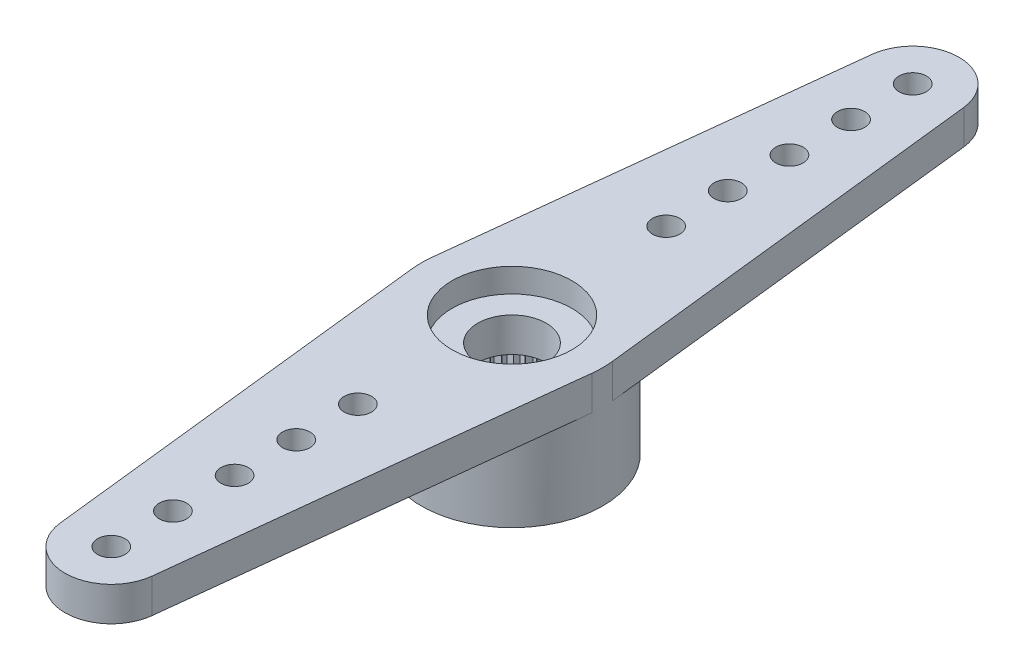
from build123d import *

# Parameters (mm, degrees)
BOSS_EXTRUDE1_DEPTH = 1.27
BOSS_EXTRUDE2_START = 3.175
SKETCH2_R           = 3.3655
BOSS_EXTRUDE2_DEPTH = 3.175
CUT_EXTRUDE1_DEPTH  = 2.286
CUT_EXTRUDE2_START  = -0.889
SKETCH4_R           = 2.2225
CUT_EXTRUDE2_DEPTH  = 0.889
CUT_EXTRUDE3_REACH  = 19.282
SKETCH5_R           = 1.27
CUT_EXTRUDE4_REACH  = 19.486
SKETCH6_R           = 0.508


with BuildPart() as part:
    # Sketch1 → Boss-Extrude1 (new body)
    with BuildSketch(Plane(origin=(0, 0, 0), x_dir=(1, 0, 0), z_dir=(0, 1, 0))):
        with BuildLine():
            Line((-1.703883799, -15.0495), (-3.34466079, -0.373944444))
            ThreePointArc((-3.34466079, -0.373944444), (-3.3655, 0), (-3.34466079, 0.373944444))
            Line((-3.34466079, 0.373944444), (-1.703883799, 15.0495))
            ThreePointArc((-1.703883799, 15.0495), (0, 16.5735), (1.703883799, 15.0495))
            Line((1.703883799, 15.0495), (3.34466079, 0.373944444))
            ThreePointArc((3.34466079, 0.373944444), (3.3655, 0), (3.34466079, -0.373944444))
            Line((3.34466079, -0.373944444), (1.703883799, -15.0495))
            ThreePointArc((1.703883799, -15.0495), (0, -16.5735), (-1.703883799, -15.0495))
        make_face()
    extrude(amount=BOSS_EXTRUDE1_DEPTH)

    # Sketch2 → Boss-Extrude2 (add)
    with BuildSketch(Plane.XZ.offset(BOSS_EXTRUDE2_START)):
        with Locations(Location((0, 0, 0), (0, 0, 270))):
            Circle(SKETCH2_R)
    extrude(amount=-BOSS_EXTRUDE2_DEPTH)

    # Sketch3 → Cut-Extrude1 (cut)
    with BuildSketch(Plane(origin=(0, -3.175, 0), x_dir=(-1, 0, 0), z_dir=(0, -1, 0))):
        with BuildLine():
            Line((0.344662185, 2.452398872), (0.160511142, 2.216696286))
            ThreePointArc((0.160511142, 2.216696286), (0.155033763, 2.217086102), (0.149555438, 2.217462383))
            Line((0.149555438, 2.217462383), (0, 2.4765))
            Line((0, 2.4765), (-0.149555438, 2.217462383))
            ThreePointArc((-0.149555438, 2.217462383), (-0.155033763, 2.217086102), (-0.160511142, 2.216696286))
            Line((-0.160511142, 2.216696286), (-0.344662185, 2.452398872))
            Line((-0.344662185, 2.452398872), (-0.456711091, 2.175068098))
            ThreePointArc((-0.456711091, 2.175068098), (-0.462083733, 2.173933043), (-0.467453554, 2.172784717))
            Line((-0.467453554, 2.172784717), (-0.682615912, 2.38056459))
            Line((-0.682615912, 2.38056459), (-0.754977382, 2.090338586))
            ThreePointArc((-0.754977382, 2.090338586), (-0.760139769, 2.08846685), (-0.765297515, 2.086582364))
            Line((-0.765297515, 2.086582364), (-1.007283297, 2.262395326))
            Line((-1.007283297, 2.262395326), (-1.038548897, 1.964923011))
            ThreePointArc((-1.038548897, 1.964923011), (-1.043400548, 1.962351025), (-1.04824583, 1.95976706))
            Line((-1.04824583, 1.95976706), (-1.312345058, 2.10019111))
            Line((-1.312345058, 2.10019111), (-1.301906239, 1.801262445))
            ThreePointArc((-1.301906239, 1.801262445), (-1.306352723, 1.79804027), (-1.310791233, 1.794807119))
            Line((-1.310791233, 1.794807119), (-1.591863515, 1.897109063))
            Line((-1.591863515, 1.897109063), (-1.539923457, 1.602542354))
            ThreePointArc((-1.539923457, 1.602542354), (-1.543878228, 1.598732706), (-1.547823575, 1.594913299))
            Line((-1.547823575, 1.594913299), (-1.84039816, 1.657101947))
            Line((-1.84039816, 1.657101947), (-1.747967817, 1.372630599))
            ThreePointArc((-1.747967817, 1.372630599), (-1.7513539, 1.368307629), (-1.754729292, 1.363976306))
            Line((-1.754729292, 1.363976306), (-2.053111548, 1.384841225))
            Line((-2.053111548, 1.384841225), (-1.921989971, 1.116002151))
            ThreePointArc((-1.921989971, 1.116002151), (-1.92474146, 1.11125), (-1.927481199, 1.106491065))
            Line((-1.927481199, 1.106491065), (-2.225863456, 1.085626145))
            Line((-2.225863456, 1.085626145), (-2.058602777, 0.837651991))
            ThreePointArc((-2.058602777, 0.837651991), (-2.060666117, 0.832563154), (-2.062716877, 0.827469234))
            Line((-2.062716877, 0.827469234), (-2.355291463, 0.765280587))
            Line((-2.355291463, 0.765280587), (-2.155147221, 0.542997887))
            ThreePointArc((-2.155147221, 0.542997887), (-2.156482252, 0.537671413), (-2.157804118, 0.532341657))
            Line((-2.157804118, 0.532341657), (-2.4388764, 0.430039712))
            Line((-2.4388764, 0.430039712), (-2.209744176, 0.237774947))
            ThreePointArc((-2.209744176, 0.237774947), (-2.210324912, 0.23231451), (-2.210892156, 0.226852654))
            Line((-2.210892156, 0.226852654), (-2.474991383, 0.086428604))
            Line((-2.474991383, 0.086428604), (-2.221330975, -0.072076012))
            ThreePointArc((-2.221330975, -0.072076012), (-2.221146113, -0.077564131), (-2.220947692, -0.083051778))
            Line((-2.220947692, -0.083051778), (-2.462933474, -0.258864739))
            Line((-2.462933474, -0.258864739), (-2.189682092, -0.380524093))
            ThreePointArc((-2.189682092, -0.380524093), (-2.188735231, -0.385933075), (-2.187775009, -0.391339701))
            Line((-2.187775009, -0.391339701), (-2.402937366, -0.599119574))
            Line((-2.402937366, -0.599119574), (-2.115413539, -0.681565705))
            ThreePointArc((-2.115413539, -0.681565705), (-2.113723107, -0.68679027), (-2.112019773, -0.692010642))
            Line((-2.112019773, -0.692010642), (-2.296170816, -0.927713229))
            Line((-2.296170816, -0.927713229), (-1.999970867, -0.969341417))
            ThreePointArc((-1.999970867, -0.969341417), (-1.997569768, -0.974279874), (-1.995156475, -0.979212383))
            Line((-1.995156475, -0.979212383), (-2.144711912, -1.23825))
            Line((-2.144711912, -1.23825), (-1.845601037, -1.23825))
            ThreePointArc((-1.845601037, -1.23825), (-1.842536005, -1.242806228), (-1.839459725, -1.247354869))
            Line((-1.839459725, -1.247354869), (-1.951508631, -1.524685644))
            Line((-1.951508631, -1.524685644), (-1.655308682, -1.483057456))
            ThreePointArc((-1.655308682, -1.483057456), (-1.651639375, -1.487142773), (-1.647959984, -1.491219011))
            Line((-1.647959984, -1.491219011), (-1.720321454, -1.781445016))
            Line((-1.720321454, -1.781445016), (-1.432797627, -1.698998885))
            ThreePointArc((-1.432797627, -1.698998885), (-1.428595463, -1.702533775), (-1.424384577, -1.706058272))
            Line((-1.424384577, -1.706058272), (-1.455650177, -2.003530587))
            Line((-1.455650177, -2.003530587), (-1.182398796, -1.881871233))
            ThreePointArc((-1.182398796, -1.881871233), (-1.177745565, -1.884786894), (-1.173085144, -1.887691048))
            Line((-1.173085144, -1.887691048), (-1.162646325, -2.186619714))
            Line((-1.162646325, -2.186619714), (-0.908985917, -2.028115099))
            ThreePointArc((-0.908985917, -2.028115099), (-0.903972189, -2.03035478), (-0.898952943, -2.032582066))
            Line((-0.898952943, -2.032582066), (-0.847012885, -2.327148775))
            Line((-0.847012885, -2.327148775), (-0.617880661, -2.134884011))
            ThreePointArc((-0.617880661, -2.134884011), (-0.612604023, -2.136404119), (-0.607323646, -2.137911186))
            Line((-0.607323646, -2.137911186), (-0.514893302, -2.422382533))
            Line((-0.514893302, -2.422382533), (-0.314749061, -2.200099834))
            ThreePointArc((-0.314749061, -2.200099834), (-0.309312217, -2.200870783), (-0.303873485, -2.201628296))
            Line((-0.303873485, -2.201628296), (-0.172751907, -2.47046737))
            Line((-0.172751907, -2.47046737), (-0.005491228, -2.222493216))
            ThreePointArc((-0.005491228, -2.222493216), (0, -2.2225), (0.005491228, -2.222493216))
            Line((0.005491228, -2.222493216), (0.172751907, -2.47046737))
            Line((0.172751907, -2.47046737), (0.303873485, -2.201628296))
            ThreePointArc((0.303873485, -2.201628296), (0.309312217, -2.200870783), (0.314749061, -2.200099834))
            Line((0.314749061, -2.200099834), (0.514893302, -2.422382533))
            Line((0.514893302, -2.422382533), (0.607323646, -2.137911186))
            ThreePointArc((0.607323646, -2.137911186), (0.612604023, -2.136404119), (0.617880661, -2.134884011))
            Line((0.617880661, -2.134884011), (0.847012885, -2.327148775))
            Line((0.847012885, -2.327148775), (0.898952943, -2.032582066))
            ThreePointArc((0.898952943, -2.032582066), (0.903972189, -2.03035478), (0.908985917, -2.028115099))
            Line((0.908985917, -2.028115099), (1.162646325, -2.186619714))
            Line((1.162646325, -2.186619714), (1.173085144, -1.887691048))
            ThreePointArc((1.173085144, -1.887691048), (1.177745565, -1.884786894), (1.182398796, -1.881871233))
            Line((1.182398796, -1.881871233), (1.455650177, -2.003530587))
            Line((1.455650177, -2.003530587), (1.424384577, -1.706058272))
            ThreePointArc((1.424384577, -1.706058272), (1.428595463, -1.702533775), (1.432797627, -1.698998885))
            Line((1.432797627, -1.698998885), (1.720321454, -1.781445016))
            Line((1.720321454, -1.781445016), (1.647959984, -1.491219011))
            ThreePointArc((1.647959984, -1.491219011), (1.651639375, -1.487142773), (1.655308682, -1.483057456))
            Line((1.655308682, -1.483057456), (1.951508631, -1.524685644))
            Line((1.951508631, -1.524685644), (1.839459725, -1.247354869))
            ThreePointArc((1.839459725, -1.247354869), (1.842536005, -1.242806228), (1.845601037, -1.23825))
            Line((1.845601037, -1.23825), (2.144711912, -1.23825))
            Line((2.144711912, -1.23825), (1.995156475, -0.979212383))
            ThreePointArc((1.995156475, -0.979212383), (1.997569768, -0.974279874), (1.999970867, -0.969341417))
            Line((1.999970867, -0.969341417), (2.296170816, -0.927713229))
            Line((2.296170816, -0.927713229), (2.112019773, -0.692010642))
            ThreePointArc((2.112019773, -0.692010642), (2.113723107, -0.68679027), (2.115413539, -0.681565705))
            Line((2.115413539, -0.681565705), (2.402937366, -0.599119574))
            Line((2.402937366, -0.599119574), (2.187775009, -0.391339701))
            ThreePointArc((2.187775009, -0.391339701), (2.188735231, -0.385933075), (2.189682092, -0.380524093))
            Line((2.189682092, -0.380524093), (2.462933474, -0.258864739))
            Line((2.462933474, -0.258864739), (2.220947692, -0.083051778))
            ThreePointArc((2.220947692, -0.083051778), (2.221146113, -0.077564131), (2.221330975, -0.072076012))
            Line((2.221330975, -0.072076012), (2.474991383, 0.086428604))
            Line((2.474991383, 0.086428604), (2.210892156, 0.226852654))
            ThreePointArc((2.210892156, 0.226852654), (2.210324912, 0.23231451), (2.209744176, 0.237774947))
            Line((2.209744176, 0.237774947), (2.4388764, 0.430039712))
            Line((2.4388764, 0.430039712), (2.157804118, 0.532341657))
            ThreePointArc((2.157804118, 0.532341657), (2.156482252, 0.537671413), (2.155147221, 0.542997887))
            Line((2.155147221, 0.542997887), (2.355291463, 0.765280587))
            Line((2.355291463, 0.765280587), (2.062716877, 0.827469234))
            ThreePointArc((2.062716877, 0.827469234), (2.060666117, 0.832563154), (2.058602777, 0.837651991))
            Line((2.058602777, 0.837651991), (2.225863456, 1.085626145))
            Line((2.225863456, 1.085626145), (1.927481199, 1.106491065))
            ThreePointArc((1.927481199, 1.106491065), (1.92474146, 1.11125), (1.921989971, 1.116002151))
            Line((1.921989971, 1.116002151), (2.053111548, 1.384841225))
            Line((2.053111548, 1.384841225), (1.754729292, 1.363976306))
            ThreePointArc((1.754729292, 1.363976306), (1.7513539, 1.368307629), (1.747967817, 1.372630599))
            Line((1.747967817, 1.372630599), (1.84039816, 1.657101947))
            Line((1.84039816, 1.657101947), (1.547823575, 1.594913299))
            ThreePointArc((1.547823575, 1.594913299), (1.543878228, 1.598732706), (1.539923457, 1.602542354))
            Line((1.539923457, 1.602542354), (1.591863515, 1.897109063))
            Line((1.591863515, 1.897109063), (1.310791233, 1.794807119))
            ThreePointArc((1.310791233, 1.794807119), (1.306352723, 1.79804027), (1.301906239, 1.801262445))
            Line((1.301906239, 1.801262445), (1.312345058, 2.10019111))
            Line((1.312345058, 2.10019111), (1.04824583, 1.95976706))
            ThreePointArc((1.04824583, 1.95976706), (1.043400548, 1.962351025), (1.038548897, 1.964923011))
            Line((1.038548897, 1.964923011), (1.007283297, 2.262395326))
            Line((1.007283297, 2.262395326), (0.765297515, 2.086582364))
            ThreePointArc((0.765297515, 2.086582364), (0.760139769, 2.08846685), (0.754977382, 2.090338586))
            Line((0.754977382, 2.090338586), (0.682615912, 2.38056459))
            Line((0.682615912, 2.38056459), (0.467453554, 2.172784717))
            ThreePointArc((0.467453554, 2.172784717), (0.462083733, 2.173933043), (0.456711091, 2.175068098))
            Line((0.456711091, 2.175068098), (0.344662185, 2.452398872))
        make_face()
    extrude(amount=-CUT_EXTRUDE1_DEPTH, mode=Mode.SUBTRACT)

    # Sketch4 → Cut-Extrude2 (cut)
    with BuildSketch(Plane(origin=(0, 1.27, 0), x_dir=(1, 0, 0), z_dir=(0, 1, 0)).offset(CUT_EXTRUDE2_START)):
        with Locations(Location((0, 0, 0), (0, 0, 270))):
            Circle(SKETCH4_R)
    extrude(amount=CUT_EXTRUDE2_DEPTH, mode=Mode.SUBTRACT)

    # Sketch5 → Cut-Extrude3 (cut, up to next)
    with BuildSketch(Plane(origin=(0, 0.381, 0), x_dir=(1, 0, 0), z_dir=(0, 1, 0)), mode=Mode.PRIVATE) as cut_extrude3_sk1:
        with Locations(Location((0, 0, 0), (0, 0, 270))):
            Circle(SKETCH5_R)
    cut_extrude3_tool1 = extrude(cut_extrude3_sk1.sketch, amount=-CUT_EXTRUDE3_REACH, mode=Mode.PRIVATE) & part.part
    add(cut_extrude3_tool1.solids().sort_by_distance((0, 0.381, 0))[0], mode=Mode.SUBTRACT)

    # Sketch6 → Cut-Extrude4 (cut, up to next)
    with BuildSketch(Plane(origin=(0, 1.27, 0), x_dir=(1, 0, 0), z_dir=(0, 1, 0)), mode=Mode.PRIVATE) as cut_extrude4_sk1:
        with Locations(Location((0, -14.859, 0), (0, 0, 270))):
            Circle(SKETCH6_R)
    cut_extrude4_tool1 = extrude(cut_extrude4_sk1.sketch, amount=-CUT_EXTRUDE4_REACH, mode=Mode.PRIVATE) & part.part
    # Sketch6 → Cut-Extrude4 (cut, up to next)
    with BuildSketch(Plane(origin=(0, 1.27, 0), x_dir=(1, 0, 0), z_dir=(0, 1, 0)), mode=Mode.PRIVATE) as cut_extrude4_sk2:
        with Locations(Location((0, -12.573, 0), (0, 0, 270))):
            Circle(SKETCH6_R)
    cut_extrude4_tool2 = extrude(cut_extrude4_sk2.sketch, amount=-CUT_EXTRUDE4_REACH, mode=Mode.PRIVATE) & part.part
    # Sketch6 → Cut-Extrude4 (cut, up to next)
    with BuildSketch(Plane(origin=(0, 1.27, 0), x_dir=(1, 0, 0), z_dir=(0, 1, 0)), mode=Mode.PRIVATE) as cut_extrude4_sk3:
        with Locations(Location((0, -10.287, 0), (0, 0, 270))):
            Circle(SKETCH6_R)
    cut_extrude4_tool3 = extrude(cut_extrude4_sk3.sketch, amount=-CUT_EXTRUDE4_REACH, mode=Mode.PRIVATE) & part.part
    # Sketch6 → Cut-Extrude4 (cut, up to next)
    with BuildSketch(Plane(origin=(0, 1.27, 0), x_dir=(1, 0, 0), z_dir=(0, 1, 0)), mode=Mode.PRIVATE) as cut_extrude4_sk4:
        with Locations(Location((0, -8.001, 0), (0, 0, 270))):
            Circle(SKETCH6_R)
    cut_extrude4_tool4 = extrude(cut_extrude4_sk4.sketch, amount=-CUT_EXTRUDE4_REACH, mode=Mode.PRIVATE) & part.part
    # Sketch6 → Cut-Extrude4 (cut, up to next)
    with BuildSketch(Plane(origin=(0, 1.27, 0), x_dir=(1, 0, 0), z_dir=(0, 1, 0)), mode=Mode.PRIVATE) as cut_extrude4_sk5:
        with Locations(Location((0, -5.715, 0), (0, 0, 270))):
            Circle(SKETCH6_R)
    cut_extrude4_tool5 = extrude(cut_extrude4_sk5.sketch, amount=-CUT_EXTRUDE4_REACH, mode=Mode.PRIVATE) & part.part
    # Sketch6 → Cut-Extrude4 (cut, up to next)
    with BuildSketch(Plane(origin=(0, 1.27, 0), x_dir=(1, 0, 0), z_dir=(0, 1, 0)), mode=Mode.PRIVATE) as cut_extrude4_sk6:
        with Locations(Location((0, 5.715, 0), (0, 0, 270))):
            Circle(SKETCH6_R)
    cut_extrude4_tool6 = extrude(cut_extrude4_sk6.sketch, amount=-CUT_EXTRUDE4_REACH, mode=Mode.PRIVATE) & part.part
    # Sketch6 → Cut-Extrude4 (cut, up to next)
    with BuildSketch(Plane(origin=(0, 1.27, 0), x_dir=(1, 0, 0), z_dir=(0, 1, 0)), mode=Mode.PRIVATE) as cut_extrude4_sk7:
        with Locations(Location((0, 8.001, 0), (0, 0, 270))):
            Circle(SKETCH6_R)
    cut_extrude4_tool7 = extrude(cut_extrude4_sk7.sketch, amount=-CUT_EXTRUDE4_REACH, mode=Mode.PRIVATE) & part.part
    # Sketch6 → Cut-Extrude4 (cut, up to next)
    with BuildSketch(Plane(origin=(0, 1.27, 0), x_dir=(1, 0, 0), z_dir=(0, 1, 0)), mode=Mode.PRIVATE) as cut_extrude4_sk8:
        with Locations(Location((0, 10.287, 0), (0, 0, 270))):
            Circle(SKETCH6_R)
    cut_extrude4_tool8 = extrude(cut_extrude4_sk8.sketch, amount=-CUT_EXTRUDE4_REACH, mode=Mode.PRIVATE) & part.part
    # Sketch6 → Cut-Extrude4 (cut, up to next)
    with BuildSketch(Plane(origin=(0, 1.27, 0), x_dir=(1, 0, 0), z_dir=(0, 1, 0)), mode=Mode.PRIVATE) as cut_extrude4_sk9:
        with Locations(Location((0, 12.573, 0), (0, 0, 270))):
            Circle(SKETCH6_R)
    cut_extrude4_tool9 = extrude(cut_extrude4_sk9.sketch, amount=-CUT_EXTRUDE4_REACH, mode=Mode.PRIVATE) & part.part
    # Sketch6 → Cut-Extrude4 (cut, up to next)
    with BuildSketch(Plane(origin=(0, 1.27, 0), x_dir=(1, 0, 0), z_dir=(0, 1, 0)), mode=Mode.PRIVATE) as cut_extrude4_sk10:
        with Locations(Location((0, 14.859, 0), (0, 0, 270))):
            Circle(SKETCH6_R)
    cut_extrude4_tool10 = extrude(cut_extrude4_sk10.sketch, amount=-CUT_EXTRUDE4_REACH, mode=Mode.PRIVATE) & part.part
    add(cut_extrude4_tool1.solids().sort_by_distance((0, 1.27, 14.859))[0], mode=Mode.SUBTRACT)
    add(cut_extrude4_tool2.solids().sort_by_distance((0, 1.27, 12.573))[0], mode=Mode.SUBTRACT)
    add(cut_extrude4_tool3.solids().sort_by_distance((0, 1.27, 10.287))[0], mode=Mode.SUBTRACT)
    add(cut_extrude4_tool4.solids().sort_by_distance((0, 1.27, 8.001))[0], mode=Mode.SUBTRACT)
    add(cut_extrude4_tool5.solids().sort_by_distance((0, 1.27, 5.715))[0], mode=Mode.SUBTRACT)
    add(cut_extrude4_tool6.solids().sort_by_distance((0, 1.27, -5.715))[0], mode=Mode.SUBTRACT)
    add(cut_extrude4_tool7.solids().sort_by_distance((0, 1.27, -8.001))[0], mode=Mode.SUBTRACT)
    add(cut_extrude4_tool8.solids().sort_by_distance((0, 1.27, -10.287))[0], mode=Mode.SUBTRACT)
    add(cut_extrude4_tool9.solids().sort_by_distance((0, 1.27, -12.573))[0], mode=Mode.SUBTRACT)
    add(cut_extrude4_tool10.solids().sort_by_distance((0, 1.27, -14.859))[0], mode=Mode.SUBTRACT)


solid = part.part
